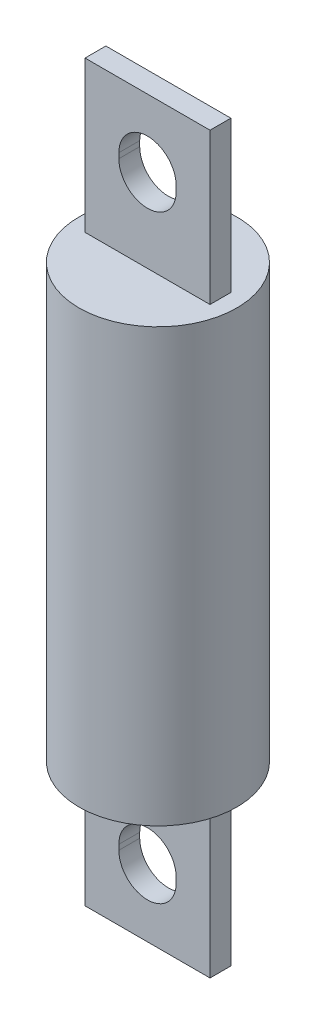
from build123d import *

# Parameters (mm, degrees)
SKETCH1_R           = 12.0269
BOSS_EXTRUDE1_DEPTH = 65.8876
SKETCH2_W           = 19.05
SKETCH2_H           = 3.175
BOSS_EXTRUDE2_DEPTH = 23.0124
CUT_EXTRUDE1_DEPTH  = 91.737027783


with BuildPart() as part:
    # Sketch1 → Boss-Extrude1 (new body)
    with BuildSketch(Plane(origin=(0, 0, 0), x_dir=(1, 0, 0), z_dir=(0, 1, 0))):
        with Locations(Location((0, 0, 0), (0, 0, 270))):
            Circle(SKETCH1_R)
    extrude(amount=BOSS_EXTRUDE1_DEPTH)

    # Sketch2 → Boss-Extrude2 (add)
    with BuildSketch(Plane(origin=(0, 65.8876, 0), x_dir=(1, 0, 0), z_dir=(0, 1, 0))):
        Rectangle(SKETCH2_W, SKETCH2_H)
    boss_extrude2 = extrude(amount=BOSS_EXTRUDE2_DEPTH)

    # Sketch3 → Cut-Extrude1 (cut, through all)
    with BuildSketch(Plane.XY.offset(1.5875)):
        with BuildLine():
            Line((-4.3688, 78.98511), (-4.3688, 78.1939))
            ThreePointArc((-4.3688, 78.1939), (0, 73.8251), (4.3688, 78.1939))
            Line((4.3688, 78.1939), (4.3688, 78.98511))
            ThreePointArc((4.3688, 78.98511), (0, 83.35391), (-4.3688, 78.98511))
        make_face()
    cut_extrude1 = extrude(amount=-CUT_EXTRUDE1_DEPTH, mode=Mode.SUBTRACT)

    # Mirror2: Boss-Extrude2, Cut-Extrude1 across plane
    add(boss_extrude2.mirror(Plane.ZX.offset(32.9438)))
    add(cut_extrude1.mirror(Plane.ZX.offset(32.9438)), mode=Mode.SUBTRACT)


solid = part.part
